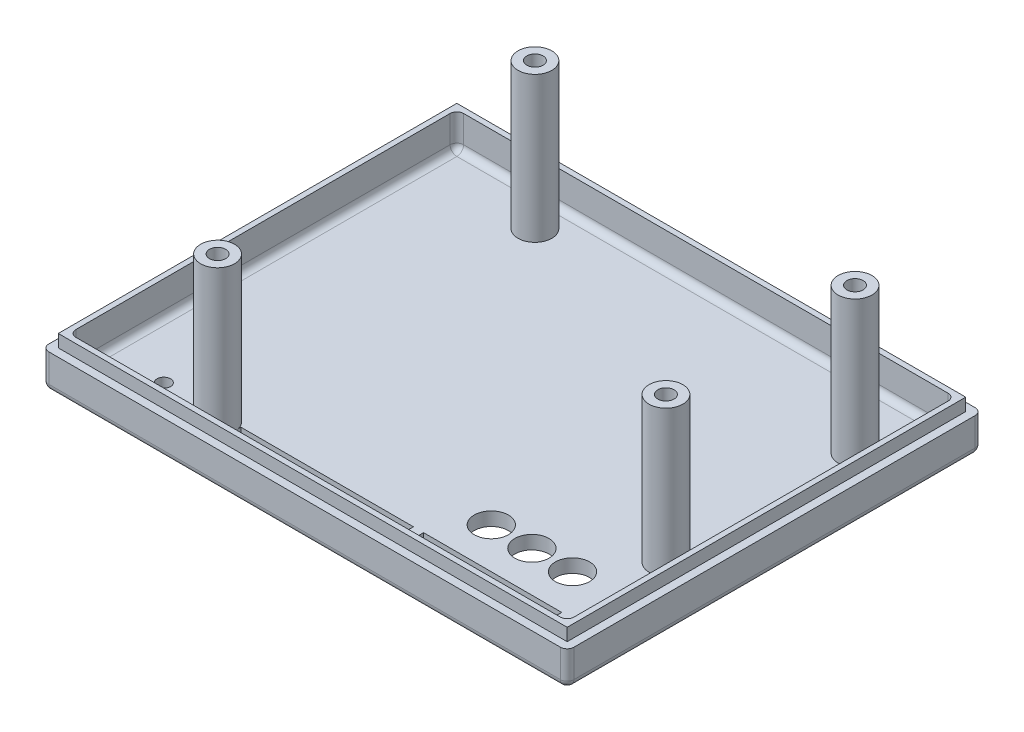
from build123d import *

# Parameters (mm, degrees)
SKETCH1_W               = 77.6
SKETCH1_H               = 61.3
BOSS_EXTRUDE1_DEPTH     = 7
SKETCH2_W               = 95.2
SKETCH2_H               = 78.9
SKETCH2_W_2             = 75.2
SKETCH2_H_2             = 58.9
CUT_EXTRUDE_THIN1_DEPTH = 1.85
SKETCH3_W               = 73.6
SKETCH3_H               = 57.3
CUT_EXTRUDE1_DEPTH      = 5
FILLET1_R               = 1
CUT_EXTRUDE3_REACH      = 51.698
SKETCH5_W               = 20.41
SKETCH5_H               = 2.7
SKETCH5_W_2             = 25.49
SKETCH6_R               = 2.5
BOSS_EXTRUDE2_DEPTH     = 21.5
SKETCH7_R               = 1.2
CUT_EXTRUDE4_DEPTH      = 5
CUT_EXTRUDE5_REACH      = 55.918
SKETCH8_R               = 1
SKETCH10_R              = 2.525
CUT_EXTRUDE6_DEPTH      = 2


with BuildPart() as part:
    # Sketch1 → Boss-Extrude1 (new body)
    with BuildSketch(Plane(origin=(0, 0, 0), x_dir=(1, 0, 0), z_dir=(0, 1, 0))):
        Rectangle(SKETCH1_W, SKETCH1_H)
    extrude(amount=BOSS_EXTRUDE1_DEPTH)

    # Sketch2 → Cut-Extrude-Thin1 (cut)
    with BuildSketch(Plane(origin=(0, 7, 0), x_dir=(1, 0, 0), z_dir=(0, 1, 0))):
        Rectangle(SKETCH2_W, SKETCH2_H)
        Rectangle(SKETCH2_W_2, SKETCH2_H_2, mode=Mode.SUBTRACT)
    extrude(amount=-CUT_EXTRUDE_THIN1_DEPTH, mode=Mode.SUBTRACT)

    # Sketch3 → Cut-Extrude1 (cut)
    with BuildSketch(Plane(origin=(0, 7, 0), x_dir=(1, 0, 0), z_dir=(0, 1, 0))):
        Rectangle(SKETCH3_W, SKETCH3_H)
    extrude(amount=-CUT_EXTRUDE1_DEPTH, mode=Mode.SUBTRACT)

    # Fillet1
    fillet1_edges = [part.edges().sort_by_distance(p)[0] for p in [
        (38.8, 2.575, 30.65),
        (-38.8, 2.575, 30.65),
        (-38.8, 2.575, -30.65),
        (38.8, 2.575, -30.65),
        (36.8, 2, 0),
        (36.8, 4.5, -28.65),
        (0, 2, 28.65),
        (36.8, 4.5, 28.65),
        (-36.8, 2, 0),
        (-36.8, 4.5, 28.65),
        (0, 2, -28.65),
        (-36.8, 4.5, -28.65),
        (0, 0, 30.65),
        (-38.8, 0, 0),
        (0, 0, -30.65),
        (38.8, 0, 0),
    ]]
    fillet(fillet1_edges, radius=FILLET1_R)

    # Sketch5 → Cut-Extrude3 (cut, up to next)
    with BuildSketch(Plane(origin=(0, 2, 0), x_dir=(1, 0, 0), z_dir=(0, 1, 0)), mode=Mode.PRIVATE) as cut_extrude3_sk1:
        with Locations((20.095, -24.3)):
            Rectangle(SKETCH5_W, SKETCH5_H)
    cut_extrude3_tool1 = extrude(cut_extrude3_sk1.sketch, amount=-CUT_EXTRUDE3_REACH, mode=Mode.PRIVATE) & part.part
    # Sketch5 → Cut-Extrude3 (cut, up to next)
    with BuildSketch(Plane(origin=(0, 2, 0), x_dir=(1, 0, 0), z_dir=(0, 1, 0)), mode=Mode.PRIVATE) as cut_extrude3_sk2:
        with Locations((-4.355, -24.3)):
            Rectangle(SKETCH5_W_2, SKETCH5_H)
    cut_extrude3_tool2 = extrude(cut_extrude3_sk2.sketch, amount=-CUT_EXTRUDE3_REACH, mode=Mode.PRIVATE) & part.part
    add(cut_extrude3_tool1.solids().sort_by_distance((20.095, 2, 24.3))[0], mode=Mode.SUBTRACT)
    add(cut_extrude3_tool2.solids().sort_by_distance((-4.355, 2, 24.3))[0], mode=Mode.SUBTRACT)

    # Sketch6 → Boss-Extrude2 (add)
    with BuildSketch(Plane(origin=(0, 2, 0), x_dir=(1, 0, 0), z_dir=(0, 1, 0))):
        with Locations(Location((31.6, 19.09, 0), (0, 0, 270))):
            Circle(SKETCH6_R)
        with Locations(Location((31.6, -8.85, 0), (0, 0, 270))):
            Circle(SKETCH6_R)
        with Locations(Location((-19.5, -24.01, 0), (0, 0, 16.260204708))):
            Circle(SKETCH6_R)
        with Locations(Location((-20.8, 24.19, 0), (0, 0, 270))):
            Circle(SKETCH6_R)
    extrude(amount=BOSS_EXTRUDE2_DEPTH)

    # Sketch7 → Cut-Extrude4 (cut)
    with BuildSketch(Plane(origin=(0, 23.5, 0), x_dir=(1, 0, 0), z_dir=(0, 1, 0))):
        with Locations(Location((31.6, 19.09, 0), (0, 0, 270))):
            Circle(SKETCH7_R)
        with Locations(Location((31.6, -8.85, 0), (0, 0, 270))):
            Circle(SKETCH7_R)
        with Locations(Location((-20.8, 24.19, 0), (0, 0, 270))):
            Circle(SKETCH7_R)
        with Locations(Location((-19.5, -24.01, 0), (0, 0, 270))):
            Circle(SKETCH7_R)
    extrude(amount=-CUT_EXTRUDE4_DEPTH, mode=Mode.SUBTRACT)

    # Sketch8 → Cut-Extrude5 (cut, up to next)
    with BuildSketch(Plane(origin=(0, 2, 0), x_dir=(1, 0, 0), z_dir=(0, 1, 0)), mode=Mode.PRIVATE) as cut_extrude5_sk1:
        with Locations(Location((-28.5, -22.95, 0), (0, 0, 270))):
            Circle(SKETCH8_R)
    cut_extrude5_tool1 = extrude(cut_extrude5_sk1.sketch, amount=-CUT_EXTRUDE5_REACH, mode=Mode.PRIVATE) & part.part
    add(cut_extrude5_tool1.solids().sort_by_distance((-28.5, 2, 22.95))[0], mode=Mode.SUBTRACT)

    # Sketch10 → Cut-Extrude6 (cut)
    with BuildSketch(Plane.XZ):
        with Locations(Location((13.89, 16.95, 0), (0, 0, 270))):
            Circle(SKETCH10_R)
        with Locations(Location((19.89, 16.95, 0), (0, 0, 270))):
            Circle(SKETCH10_R)
        with Locations(Location((25.89, 16.95, 0), (0, 0, 270))):
            Circle(SKETCH10_R)
    extrude(amount=-CUT_EXTRUDE6_DEPTH, mode=Mode.SUBTRACT)


solid = part.part
